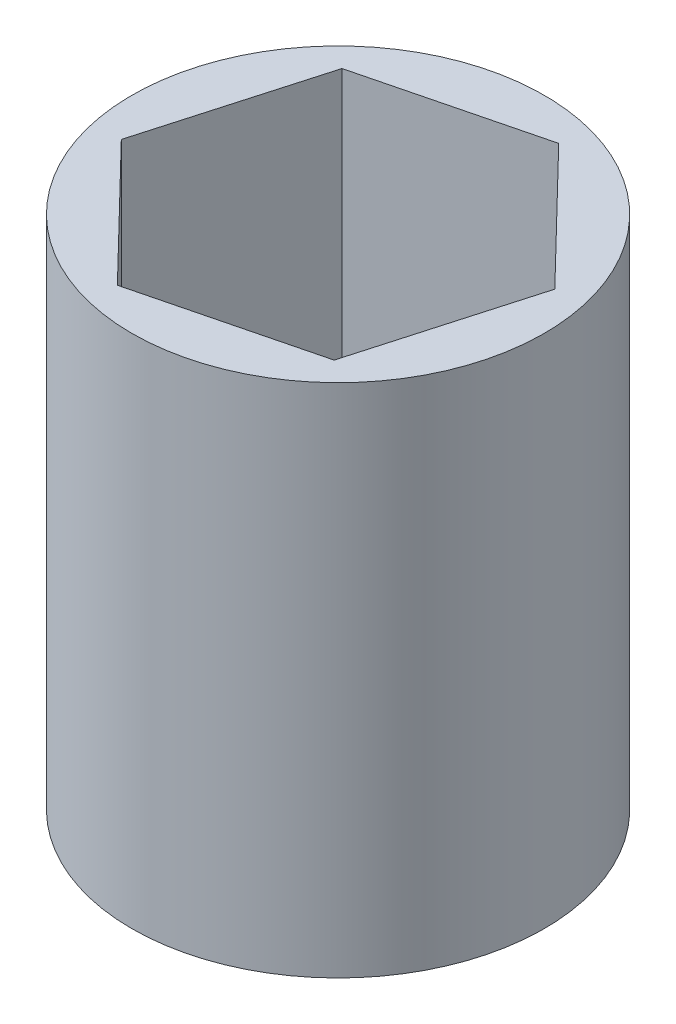
from build123d import *

# Parameters (mm, degrees)
SKETCH1_R           = 6.35
BOSS_EXTRUDE1_DEPTH = 15.875


with BuildPart() as part:
    # Sketch1 → Boss-Extrude1 (new body)
    with BuildSketch(Plane(origin=(0, 0, 0), x_dir=(1, 0, 0), z_dir=(0, 1, 0))):
        with Locations(Location((0, 0, 0), (0, 0, 270))):
            Circle(SKETCH1_R)
        Polygon((1.505663563, 5.289125848), (-3.827685567, 3.948505819), (-5.333349129, -1.340620029), (-1.505663563, -5.289125848), (3.827685567, -3.948505819), (5.333349129, 1.340620029), align=None, mode=Mode.SUBTRACT)
    extrude(amount=BOSS_EXTRUDE1_DEPTH)


solid = part.part
